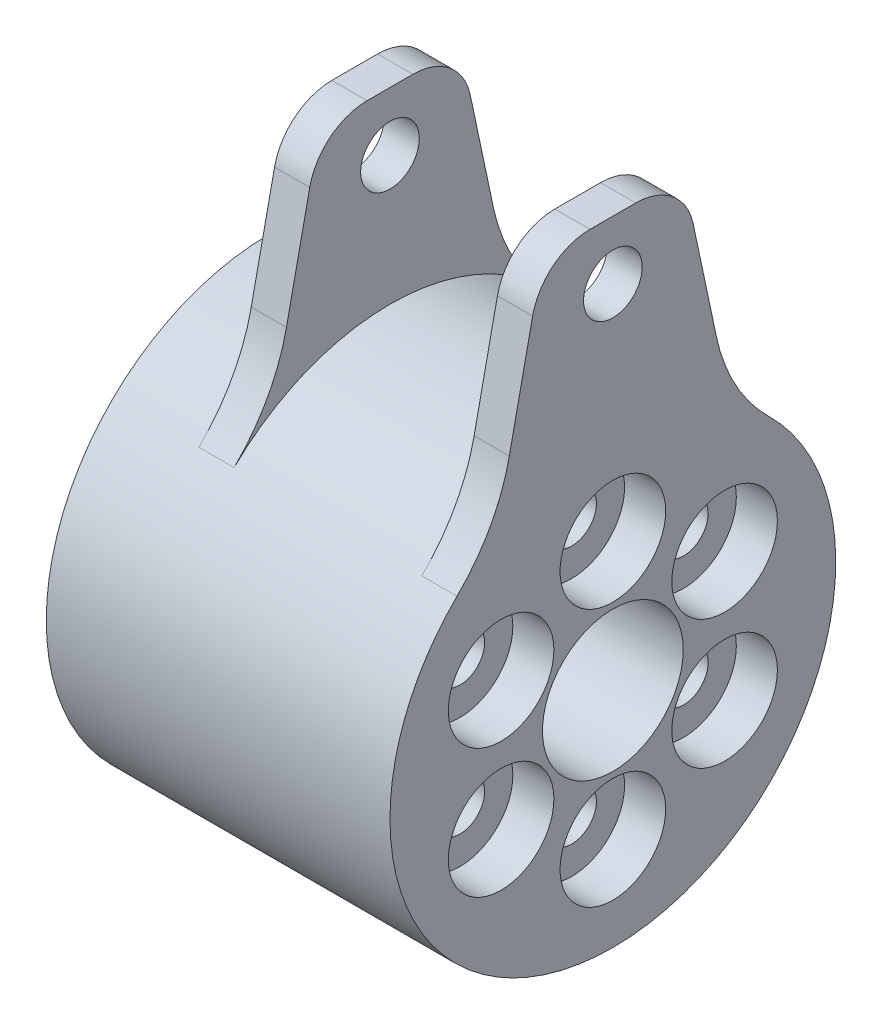
from build123d import *
from build123d.topology import SkipClean

# Parameters (mm, degrees)
SKETCH_1_R                   = 19
SKETCH_1_R_2                 = 2
SKETCH_1_R_3                 = 11
EXTRUDE_1_DEPTH              = 3
EXTRUDE_START                = -3
EXTRUDE_2_DEPTH              = 3
FILLET_1_R                   = 3
SKETCH_5_R                   = 2.5
EXTRUDE_3_DEPTH              = 3
FILLET_2_R                   = 16
FILLET_3_R                   = 5
EXTRUDE_START_2              = 8
SKETCH_8_R                   = 19
SKETCH_8_R_2                 = 2
EXTRUDE_5_DEPTH              = 8
SKETCH_9_R                   = 2
SKETCH_9_R_2                 = 2.5
EXTRUDE_6_DEPTH              = 25
CUT_EXTRUDE_START            = -17.5
CUT_EXTRUDE_1_DEPTH          = 16
EXTRUDE_START_3              = -36
SKETCH_12_R                  = 19
SKETCH_12_R_2                = 11
EXTRUDE_7_DEPTH              = 36
SKETCH_13_R                  = 6
EXTRUDE_8_DEPTH              = 36
CUT_EXTRUDE_START_2          = -36
SKETCH_14_R                  = 2
CUT_EXTRUDE_2_DEPTH          = 36
SKETCH_15_R                  = 28.71288773
CUT_EXTRUDE_3_DEPTH          = 6.7
SKETCH_17_R                  = 2
SKETCH_17_R_2                = 1.5
EXTRUDE_9_DEPTH              = 3.8
CHAMFER_2_SIZE               = 0.5
CUT_EXTRUDE_START_3          = -3
CUT_EXTRUDE_4_DEPTH          = 3
HOLE_WIZARD_M5_3_D           = 4.2
HOLE_WIZARD_M5_3_CSINK_D     = 4.25
HOLE_WIZARD_M5_3_CSINK_ANGLE = 90
SKETCH_24_R                  = 4.5
CUT_EXTRUDE_5_DEPTH          = 3.5
CUT_EXTRUDE_START_4          = -1.5
CUT_EXTRUDE_6_DEPTH          = 1.5
CUT_EXTRUDE_7_DEPTH          = 1.5
EXTRUDE_START_4              = 1.5
SKETCH_28_R                  = 2.5
EXTRUDE_10_DEPTH             = 1.5
CUT_EXTRUDE_8_DEPTH          = 1.5


with BuildPart() as part:
    # 草图1 → 凸台-拉伸1 (new body)
    with BuildSketch(Plane(origin=(0, 0, 0), x_dir=(0, 0, -1), z_dir=(1, 0, 0))):
        Circle(SKETCH_1_R)
        with Locations((0, -15)):
            Circle(SKETCH_1_R_2, mode=Mode.SUBTRACT)
        with Locations((0, 13.5)):
            Circle(SKETCH_1_R_2, mode=Mode.SUBTRACT)
        with Locations((11.691342951, -6.75)):
            Circle(SKETCH_1_R_2, mode=Mode.SUBTRACT)
        with Locations((-12.990381057, 7.5)):
            Circle(SKETCH_1_R_2, mode=Mode.SUBTRACT)
        with Locations((-11.691342951, -6.75)):
            Circle(SKETCH_1_R_2, mode=Mode.SUBTRACT)
        with Locations((12.990381057, 7.5)):
            Circle(SKETCH_1_R_2, mode=Mode.SUBTRACT)
        Circle(SKETCH_1_R_3, mode=Mode.SUBTRACT)
    extrude(amount=EXTRUDE_1_DEPTH)

    # 草图3 → 凸台-拉伸2 (add)
    with BuildSketch(Plane(origin=(3, 0, 0), x_dir=(0, 0, -1), z_dir=(1, 0, 0)).offset(EXTRUDE_START)):
        with BuildLine():
            ThreePointArc((-2.795361016, 10.638888889), (0, 9.5), (2.795361016, 10.638888889))
            ThreePointArc((2.795361016, 10.638888889), (0, 11), (-2.795361016, 10.638888889))
        make_face()
        with BuildLine():
            ThreePointArc((10.611228554, -2.898590792), (8.227241336, -4.75), (7.815867538, -7.740298097))
            ThreePointArc((7.815867538, -7.740298097), (9.526279442, -5.5), (10.611228554, -2.898590792))
        make_face()
        with BuildLine():
            ThreePointArc((-7.815867538, -7.740298097), (-8.227241336, -4.75), (-10.611228554, -2.898590792))
            ThreePointArc((-10.611228554, -2.898590792), (-9.526279442, -5.5), (-7.815867538, -7.740298097))
        make_face()
    extrude(amount=EXTRUDE_2_DEPTH)

    # 圆角1
    fillet_1_edges = [part.edges().sort_by_distance(p)[0] for p in [
        (1.5, 10.638888889, 2.795361016),
        (1.5, 10.638888889, -2.795361016),
        (1.5, -2.898590792, -10.611228554),
        (1.5, -7.740298097, -7.815867538),
        (1.5, -7.740298097, 7.815867538),
        (1.5, -2.898590792, 10.611228554),
    ]]
    fillet(fillet_1_edges, radius=FILLET_1_R)

    # 草图5 → 凸台-拉伸3 (add)
    with BuildSketch(Plane(origin=(3, 0, 0), x_dir=(0, 0, -1), z_dir=(1, 0, 0)).offset(EXTRUDE_START)):
        with BuildLine():
            Line((-6, 35), (-10, 16.155494421))
            ThreePointArc((-10, 16.155494421), (0, 19), (10, 16.155494421))
            Line((10, 16.155494421), (6, 35))
            Line((6, 35), (-6, 35))
        make_face()
        with Locations((0, 30)):
            Circle(SKETCH_5_R, mode=Mode.SUBTRACT)
    extrude(amount=EXTRUDE_3_DEPTH)

    # 圆角2
    fillet_2_edges = [part.edges().sort_by_distance(p)[0] for p in [
        (1.5, 16.155494421, 10),
        (1.5, 16.155494421, -10),
    ]]
    fillet(fillet_2_edges, radius=FILLET_2_R)

    # 圆角3
    fillet_3_edges = [part.edges().sort_by_distance(p)[0] for p in [
        (1.5, 35, -6),
        (1.5, 35, 6),
    ]]
    fillet(fillet_3_edges, radius=FILLET_3_R)

    # 草图8 → 凸台-拉伸5 (add)
    with BuildSketch(Plane.ZY.offset(EXTRUDE_START_2)):
        Circle(SKETCH_8_R)
        with Locations((0, -15)):
            Circle(SKETCH_8_R_2, mode=Mode.SUBTRACT)
        with Locations((-11.691342951, -6.75)):
            Circle(SKETCH_8_R_2, mode=Mode.SUBTRACT)
        with Locations((11.691342951, -6.75)):
            Circle(SKETCH_8_R_2, mode=Mode.SUBTRACT)
        with Locations((12.990381057, 7.5)):
            Circle(SKETCH_8_R_2, mode=Mode.SUBTRACT)
        with Locations((0, 13.5)):
            Circle(SKETCH_8_R_2, mode=Mode.SUBTRACT)
        with Locations((-12.990381057, 7.5)):
            Circle(SKETCH_8_R_2, mode=Mode.SUBTRACT)
        with BuildLine():
            ThreePointArc((9.557371648, -3.366781639), (10.505068504, -2.412656367), (10.940728111, -1.140380819))
            ThreePointArc((10.940728111, -1.140380819), (9.526279442, 5.5), (4.482765296, 10.045138889))
            ThreePointArc((4.482765296, 10.045138889), (3.163112547, 10.303984377), (1.862967396, 9.96031746))
            ThreePointArc((1.862967396, 9.96031746), (0, 9.5), (-1.862967396, 9.96031746))
            ThreePointArc((-1.862967396, 9.96031746), (-3.163112547, 10.303984377), (-4.482765296, 10.045138889))
            ThreePointArc((-4.482765296, 10.045138889), (-9.526279442, 5.5), (-10.940728111, -1.140380819))
            ThreePointArc((-10.940728111, -1.140380819), (-10.505068504, -2.412656367), (-9.557371648, -3.366781639))
            ThreePointArc((-9.557371648, -3.366781639), (-8.227241336, -4.75), (-7.694404252, -6.593535821))
            ThreePointArc((-7.694404252, -6.593535821), (-7.341955957, -7.89132801), (-6.457962814, -8.90475807))
            ThreePointArc((-6.457962814, -8.90475807), (0, -11), (6.457962814, -8.90475807))
            ThreePointArc((6.457962814, -8.90475807), (7.341955957, -7.89132801), (7.694404252, -6.593535821))
            ThreePointArc((7.694404252, -6.593535821), (8.227241336, -4.75), (9.557371648, -3.366781639))
        make_face(mode=Mode.SUBTRACT)
    extrude(amount=-EXTRUDE_5_DEPTH)

    # 草图9 → 凸台-拉伸6 (add)
    with BuildSketch(Plane(origin=(3, 0, 0), x_dir=(0, 0, -1), z_dir=(1, 0, 0))):
        with BuildLine():
            Line((8.823674386, 21.697313072), (6.840948182, 31.038186825))
            ThreePointArc((6.840948182, 31.038186825), (5.097065624, 33.885288543), (1.94991883, 35))
            Line((1.94991883, 35), (-1.94991883, 35))
            ThreePointArc((-1.94991883, 35), (-5.097065624, 33.885288543), (-6.840948182, 31.038186825))
            Line((-6.840948182, 31.038186825), (-8.823674386, 21.697313072))
            ThreePointArc((-8.823674386, 21.697313072), (-10.455022048, 17.309705025), (-13.286411369, 13.582020209))
            ThreePointArc((-13.286411369, 13.582020209), (0, -19), (13.286411369, 13.582020209))
            ThreePointArc((13.286411369, 13.582020209), (10.455022048, 17.309705025), (8.823674386, 21.697313072))
        make_face()
        with Locations(Location((0, -15, 0), (0, 0, 180))):
            Circle(SKETCH_9_R, mode=Mode.SUBTRACT)
        with Locations(Location((11.691342951, -6.75, 0), (0, 0, 180))):
            Circle(SKETCH_9_R, mode=Mode.SUBTRACT)
        with Locations(Location((-11.691342951, -6.75, 0), (0, 0, 180))):
            Circle(SKETCH_9_R, mode=Mode.SUBTRACT)
        with Locations(Location((12.990381057, 7.5, 0), (0, 0, 180))):
            Circle(SKETCH_9_R, mode=Mode.SUBTRACT)
        with Locations(Location((-12.990381057, 7.5, 0), (0, 0, 180))):
            Circle(SKETCH_9_R, mode=Mode.SUBTRACT)
        with Locations(Location((0, 13.5, 0), (0, 0, 180))):
            Circle(SKETCH_9_R, mode=Mode.SUBTRACT)
        with Locations((0, 30)):
            Circle(SKETCH_9_R_2, mode=Mode.SUBTRACT)
        with BuildLine():
            ThreePointArc((6.457962814, -8.90475807), (7.341955957, -7.89132801), (7.694404252, -6.593535821))
            ThreePointArc((7.694404252, -6.593535821), (8.227241336, -4.75), (9.557371648, -3.366781639))
            ThreePointArc((9.557371648, -3.366781639), (10.505068504, -2.412656367), (10.940728111, -1.140380819))
            ThreePointArc((10.940728111, -1.140380819), (9.526279442, 5.5), (4.482765296, 10.045138889))
            ThreePointArc((4.482765296, 10.045138889), (3.163112547, 10.303984377), (1.862967396, 9.96031746))
            ThreePointArc((1.862967396, 9.96031746), (0, 9.5), (-1.862967396, 9.96031746))
            ThreePointArc((-1.862967396, 9.96031746), (-3.163112547, 10.303984377), (-4.482765296, 10.045138889))
            ThreePointArc((-4.482765296, 10.045138889), (-9.526279442, 5.5), (-10.940728111, -1.140380819))
            ThreePointArc((-10.940728111, -1.140380819), (-10.505068504, -2.412656367), (-9.557371648, -3.366781639))
            ThreePointArc((-9.557371648, -3.366781639), (-8.227241336, -4.75), (-7.694404252, -6.593535821))
            ThreePointArc((-7.694404252, -6.593535821), (-7.341955957, -7.89132801), (-6.457962814, -8.90475807))
            ThreePointArc((-6.457962814, -8.90475807), (0, -11), (6.457962814, -8.90475807))
        make_face(mode=Mode.SUBTRACT)
    extrude(amount=EXTRUDE_6_DEPTH)

    # 草图11 → 切除-拉伸1 (cut)
    with BuildSketch(Plane.ZY.offset(-6).offset(CUT_EXTRUDE_START)):
        with BuildLine():
            Line((-6.840948182, 31.038186825), (-8.823674386, 21.697313072))
            ThreePointArc((-8.823674386, 21.697313072), (-10.455022048, 17.309705025), (-13.286411369, 13.582020209))
            ThreePointArc((-13.286411369, 13.582020209), (0, 19), (13.286411369, 13.582020209))
            ThreePointArc((13.286411369, 13.582020209), (10.455022048, 17.309705025), (8.823674386, 21.697313072))
            Line((8.823674386, 21.697313072), (6.840948182, 31.038186825))
            ThreePointArc((6.840948182, 31.038186825), (5.097065624, 33.885288543), (1.94991883, 35))
            Line((1.94991883, 35), (-1.94991883, 35))
            ThreePointArc((-1.94991883, 35), (-5.097065624, 33.885288543), (-6.840948182, 31.038186825))
        make_face()
    extrude(amount=CUT_EXTRUDE_1_DEPTH, mode=Mode.SUBTRACT)

    # 草图12 → 凸台-拉伸7 (add)
    with BuildSketch(Plane(origin=(28, 0, 0), x_dir=(0, 0, -1), z_dir=(1, 0, 0)).offset(EXTRUDE_START_3)):
        with Locations(Location((0, 0, 0), (0, 0, 180))):
            Circle(SKETCH_12_R)
        Circle(SKETCH_12_R_2, mode=Mode.SUBTRACT)
    extrude(amount=EXTRUDE_7_DEPTH)

    # 草图13 → 凸台-拉伸8 (add)
    with BuildSketch(Plane(origin=(28, 0, 0), x_dir=(0, 0, -1), z_dir=(1, 0, 0)).offset(EXTRUDE_START_3)):
        with BuildLine():
            ThreePointArc((-10.364679473, 3.684212185), (-11, 0), (-10.364679473, -3.684212185))
            ThreePointArc((-10.364679473, -3.684212185), (-7.794228634, -4.5), (-8.372961082, -7.133969633))
            ThreePointArc((-8.372961082, -7.133969633), (-5.5, -9.526279442), (-1.991718391, -10.818181818))
            ThreePointArc((-1.991718391, -10.818181818), (0, -9), (1.991718391, -10.818181818))
            ThreePointArc((1.991718391, -10.818181818), (5.5, -9.526279442), (8.372961082, -7.133969633))
            ThreePointArc((8.372961082, -7.133969633), (7.794228634, -4.5), (10.364679473, -3.684212185))
            ThreePointArc((10.364679473, -3.684212185), (11, 0), (10.364679473, 3.684212185))
            ThreePointArc((10.364679473, 3.684212185), (7.794228634, 4.5), (8.372961082, 7.133969633))
            ThreePointArc((8.372961082, 7.133969633), (5.5, 9.526279442), (1.991718391, 10.818181818))
            ThreePointArc((1.991718391, 10.818181818), (0, 9), (-1.991718391, 10.818181818))
            ThreePointArc((-1.991718391, 10.818181818), (-5.5, 9.526279442), (-8.372961082, 7.133969633))
            ThreePointArc((-8.372961082, 7.133969633), (-7.794228634, 4.5), (-10.364679473, 3.684212185))
        make_face()
        Circle(SKETCH_13_R, mode=Mode.SUBTRACT)
    extrude(amount=EXTRUDE_8_DEPTH)

    # 草图14 → 切除-拉伸2 (cut)
    with SkipClean():  # the faces are left unmerged after this step: merging them gives an invalid solid
        with BuildSketch(Plane(origin=(28, 0, 0), x_dir=(0, 0, -1), z_dir=(1, 0, 0)).offset(CUT_EXTRUDE_START_2)):
            with Locations((0, 11)):
                Circle(SKETCH_14_R)
            with Locations((-9.526279442, 5.5)):
                Circle(SKETCH_14_R)
            with Locations((-9.526279442, -5.5)):
                Circle(SKETCH_14_R)
            with Locations((0, -11)):
                Circle(SKETCH_14_R)
            with Locations((9.526279442, -5.5)):
                Circle(SKETCH_14_R)
            with Locations((9.526279442, 5.5)):
                Circle(SKETCH_14_R)
        extrude(amount=CUT_EXTRUDE_2_DEPTH, mode=Mode.SUBTRACT)

    # 草图15 → 切除-拉伸3 (cut)
    with SkipClean():  # the faces are left unmerged after this step: merging them gives an invalid solid
        with BuildSketch(Plane.ZY.offset(8)):
            Circle(SKETCH_15_R)
        extrude(amount=-CUT_EXTRUDE_3_DEPTH, mode=Mode.SUBTRACT)

    # 草图17 → 凸台-拉伸9 (add)
    with SkipClean():  # the faces are left unmerged after this step: merging them gives an invalid solid
        with BuildSketch(Plane.ZY.offset(1.3)):
            with Locations(Location((-5.5, -9.526279442, 0), (0, 0, 180))):
                Circle(SKETCH_17_R)
            with Locations(Location((-5.5, 9.526279442, 0), (0, 0, 180))):
                Circle(SKETCH_17_R_2)
            with Locations(Location((5.5, 9.526279442, 0), (0, 0, 180))):
                Circle(SKETCH_17_R)
            with Locations(Location((5.5, -9.526279442, 0), (0, 0, 180))):
                Circle(SKETCH_17_R_2)
        extrude(amount=EXTRUDE_9_DEPTH)

    # 倒角2
    chamfer_2_edges = [part.edges().sort_by_distance(p)[0] for p in [
        (-5.1, -9.526279442, -3.5),
        (-5.1, 9.526279442, -4),
        (-5.1, 9.526279442, 7.5),
        (-5.1, -9.526279442, 7),
    ]]
    chamfer(chamfer_2_edges, length=CHAMFER_2_SIZE)

    # 草图19 → 切除-拉伸4 (cut)
    with SkipClean():  # the faces are left unmerged after this step: merging them gives an invalid solid
        with BuildSketch(Plane.ZY.offset(CUT_EXTRUDE_START_3)):
            with BuildLine():
                Line((8.823674386, 21.697313072), (6.840948182, 31.038186825))
                ThreePointArc((6.840948182, 31.038186825), (5.097065624, 33.885288543), (1.94991883, 35))
                Line((1.94991883, 35), (-1.94991883, 35))
                ThreePointArc((-1.94991883, 35), (-5.097065624, 33.885288543), (-6.840948182, 31.038186825))
                Line((-6.840948182, 31.038186825), (-8.823674386, 21.697313072))
                ThreePointArc((-8.823674386, 21.697313072), (-10.455022048, 17.309705025), (-13.286411369, 13.582020209))
                ThreePointArc((-13.286411369, 13.582020209), (0, 19), (13.286411369, 13.582020209))
                ThreePointArc((13.286411369, 13.582020209), (10.455022048, 17.309705025), (8.823674386, 21.697313072))
            make_face()
        extrude(amount=CUT_EXTRUDE_4_DEPTH, mode=Mode.SUBTRACT)

    # M5 螺纹孔的螺纹孔钻头3 (through all)
    with Locations(Plane(origin=(28, 0, 0), x_dir=(0, 0, -1), z_dir=(1, 0, 0))):
        with Locations((0, 11), (9.526279442, 5.5), (9.526279442, -5.5), (0, -11), (-9.526279442, -5.5), (-9.526279442, 5.5)):
            CounterSinkHole(HOLE_WIZARD_M5_3_D / 2, HOLE_WIZARD_M5_3_CSINK_D / 2, counter_sink_angle=HOLE_WIZARD_M5_3_CSINK_ANGLE)

    # 草图24 → 切除-拉伸5 (cut)
    with BuildSketch(Plane(origin=(28, 0, 0), x_dir=(0, 0, -1), z_dir=(1, 0, 0))):
        with Locations((0, 11)):
            Circle(SKETCH_24_R)
        with Locations((9.526279442, 5.5)):
            Circle(SKETCH_24_R)
        with Locations((9.526279442, -5.5)):
            Circle(SKETCH_24_R)
        with Locations((0, -11)):
            Circle(SKETCH_24_R)
        with Locations((-9.526279442, -5.5)):
            Circle(SKETCH_24_R)
        with Locations((-9.526279442, 5.5)):
            Circle(SKETCH_24_R)
    extrude(amount=-CUT_EXTRUDE_5_DEPTH, mode=Mode.SUBTRACT)

    # 草图25 → 切除-拉伸6 (cut)
    with BuildSketch(Plane.ZY.offset(-23.5).offset(CUT_EXTRUDE_START_4)):
        with BuildLine():
            Line((8.823674386, 21.697313072), (6.840948182, 31.038186825))
            ThreePointArc((6.840948182, 31.038186825), (5.097065624, 33.885288543), (1.94991883, 35))
            Line((1.94991883, 35), (-1.94991883, 35))
            ThreePointArc((-1.94991883, 35), (-5.097065624, 33.885288543), (-6.840948182, 31.038186825))
            Line((-6.840948182, 31.038186825), (-8.823674386, 21.697313072))
            ThreePointArc((-8.823674386, 21.697313072), (-10.455022048, 17.309705025), (-13.286411369, 13.582020209))
            ThreePointArc((-13.286411369, 13.582020209), (0, 19), (13.286411369, 13.582020209))
            ThreePointArc((13.286411369, 13.582020209), (10.455022048, 17.309705025), (8.823674386, 21.697313072))
        make_face()
    extrude(amount=CUT_EXTRUDE_6_DEPTH, mode=Mode.SUBTRACT)

    # 草图26 → 切除-拉伸7 (cut)
    with BuildSketch(Plane.ZY.offset(-3).offset(CUT_EXTRUDE_START_4)):
        with BuildLine():
            Line((8.823674386, 21.697313072), (6.840948182, 31.038186825))
            ThreePointArc((6.840948182, 31.038186825), (5.097065624, 33.885288543), (1.94991883, 35))
            Line((1.94991883, 35), (-1.94991883, 35))
            ThreePointArc((-1.94991883, 35), (-5.097065624, 33.885288543), (-6.840948182, 31.038186825))
            Line((-6.840948182, 31.038186825), (-8.823674386, 21.697313072))
            ThreePointArc((-8.823674386, 21.697313072), (-10.455022048, 17.309705025), (-13.286411369, 13.582020209))
            ThreePointArc((-13.286411369, 13.582020209), (0, 19), (13.286411369, 13.582020209))
            ThreePointArc((13.286411369, 13.582020209), (10.455022048, 17.309705025), (8.823674386, 21.697313072))
        make_face()
    extrude(amount=CUT_EXTRUDE_7_DEPTH, mode=Mode.SUBTRACT)

    # 草图28 → 凸台-拉伸10 (add)
    with BuildSketch(Plane(origin=(7.5, 0, 0), x_dir=(0, 0, -1), z_dir=(1, 0, 0)).offset(EXTRUDE_START_4)):
        with BuildLine():
            Line((8.823674386, 21.697313072), (6.840948182, 31.038186825))
            ThreePointArc((6.840948182, 31.038186825), (5.097065624, 33.885288543), (1.94991883, 35))
            Line((1.94991883, 35), (-1.94991883, 35))
            ThreePointArc((-1.94991883, 35), (-5.097065624, 33.885288543), (-6.840948182, 31.038186825))
            Line((-6.840948182, 31.038186825), (-8.823674386, 21.697313072))
            ThreePointArc((-8.823674386, 21.697313072), (-10.455022048, 17.309705025), (-13.286411369, 13.582020209))
            ThreePointArc((-13.286411369, 13.582020209), (0, 19), (13.286411369, 13.582020209))
            ThreePointArc((13.286411369, 13.582020209), (10.455022048, 17.309705025), (8.823674386, 21.697313072))
        make_face()
        with Locations((0, 30)):
            Circle(SKETCH_28_R, mode=Mode.SUBTRACT)
    extrude(amount=-EXTRUDE_10_DEPTH)

    # 草图29 → 切除-拉伸8 (cut)
    with BuildSketch(Plane.ZY.offset(-4.5).offset(CUT_EXTRUDE_START_4)):
        with BuildLine():
            Line((8.823674386, 21.697313072), (6.840948182, 31.038186825))
            ThreePointArc((6.840948182, 31.038186825), (5.097065624, 33.885288543), (1.94991883, 35))
            Line((1.94991883, 35), (-1.94991883, 35))
            ThreePointArc((-1.94991883, 35), (-5.097065624, 33.885288543), (-6.840948182, 31.038186825))
            Line((-6.840948182, 31.038186825), (-8.823674386, 21.697313072))
            ThreePointArc((-8.823674386, 21.697313072), (-10.455022048, 17.309705025), (-13.286411369, 13.582020209))
            ThreePointArc((-13.286411369, 13.582020209), (0, 19), (13.286411369, 13.582020209))
            ThreePointArc((13.286411369, 13.582020209), (10.455022048, 17.309705025), (8.823674386, 21.697313072))
        make_face()
    extrude(amount=CUT_EXTRUDE_8_DEPTH, mode=Mode.SUBTRACT)


solid = part.part
